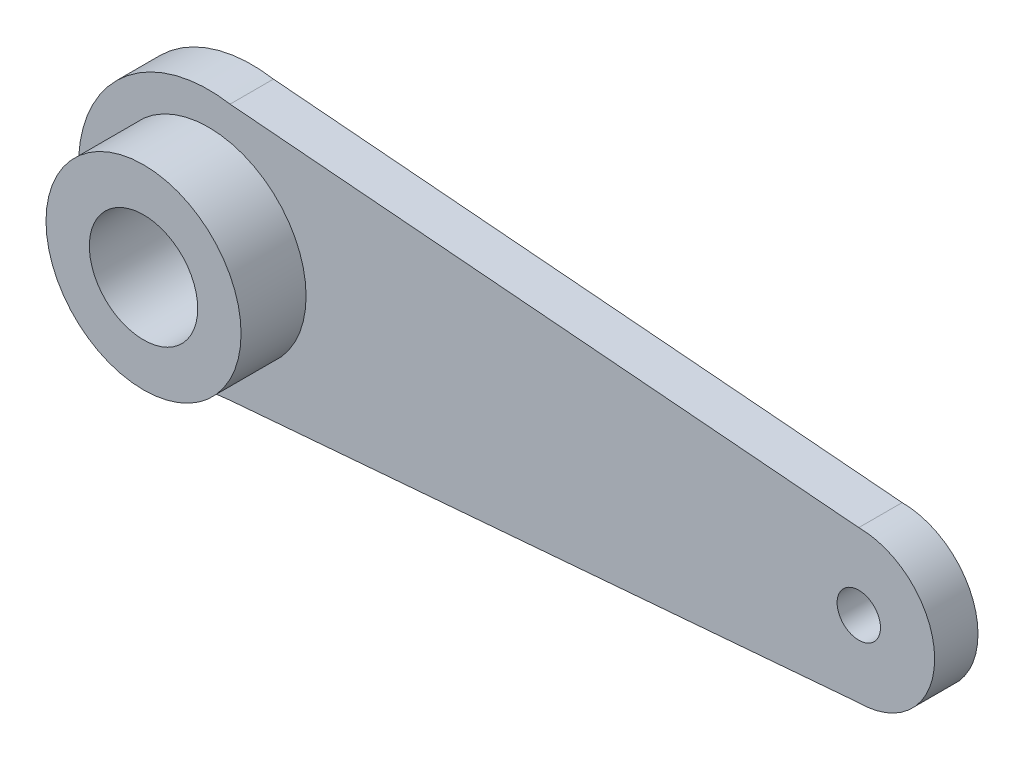
from build123d import *

# Parameters (mm, degrees)
SKETCH1_R           = 6
SKETCH1_R_2         = 3.5
BOSS_EXTRUDE1_DEPTH = 2
SKETCH2_R           = 4.5
BOSS_EXTRUDE2_DEPTH = 3
SKETCH3_R           = 2.5
CUT_EXTRUDE1_DEPTH  = 35.398401126
CUT_EXTRUDE2_DEPTH  = 35.398401126


with BuildPart() as part:
    # Sketch1 → Boss-Extrude1 (new body)
    with BuildSketch(Plane.XY):
        Circle(SKETCH1_R)
        with Locations((30, 0)):
            Circle(SKETCH1_R_2)
        Polygon((30, 3.5), (0, 6), (0, -6), (30, -3.5), align=None)
    extrude(amount=BOSS_EXTRUDE1_DEPTH)

    # Sketch2 → Boss-Extrude2 (add)
    with BuildSketch(Plane.XY.offset(2)):
        Circle(SKETCH2_R)
    extrude(amount=BOSS_EXTRUDE2_DEPTH)

    # Sketch3 → Cut-Extrude1 (cut, through all)
    with BuildSketch(Plane.XY.offset(5)):
        Circle(SKETCH3_R)
    extrude(amount=-CUT_EXTRUDE1_DEPTH, mode=Mode.SUBTRACT)

    # Sketch4 → Cut-Extrude2 (cut, through all)
    with BuildSketch(Plane(origin=(0, 0, 0), x_dir=(-1, 0, 0), z_dir=(0, 0, -1))):
        with BuildLine():
            ThreePointArc((-29, 0), (-29.292893219, 0.707106781), (-30, 1))
            Line((-30, 1), (-30, -1))
            ThreePointArc((-30, -1), (-29.292893219, -0.707106781), (-29, 0))
        make_face()
        with BuildLine():
            Line((-30, -1), (-30, 1))
            ThreePointArc((-30, 1), (-31, 0), (-30, -1))
        make_face()
    extrude(amount=-CUT_EXTRUDE2_DEPTH, mode=Mode.SUBTRACT)


solid = part.part
